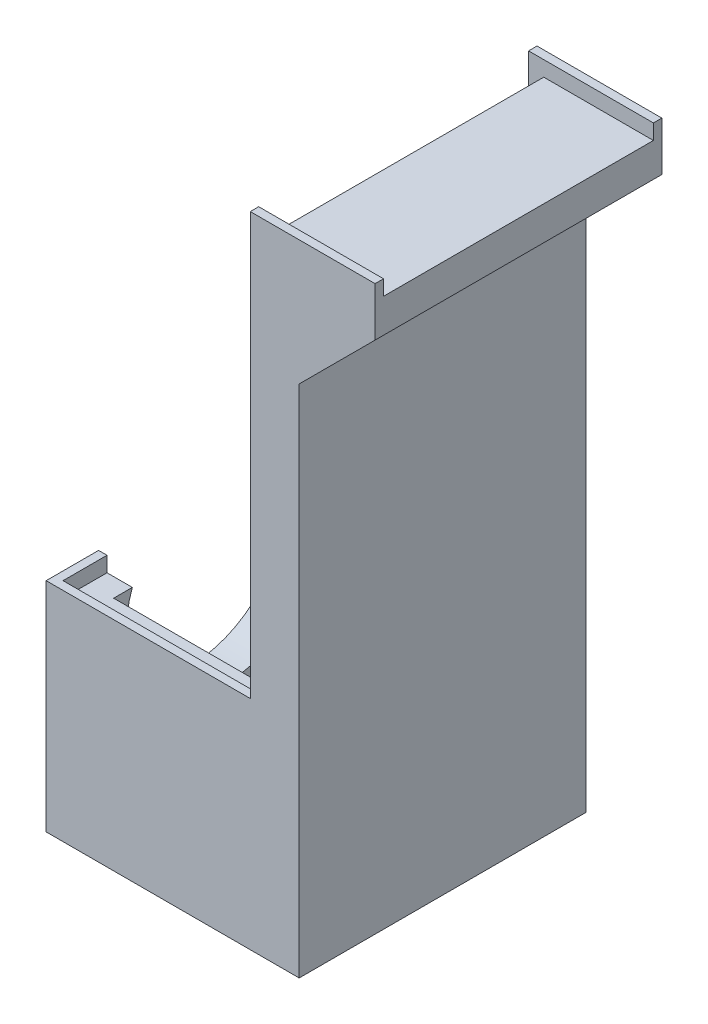
from build123d import *

# Parameters (mm, degrees)
SKETCH1_W           = 13
SKETCH1_H           = 17
BOSS_EXTRUDE1_DEPTH = 2
BOSS_EXTRUDE2_DEPTH = 10
SKETCH3_R           = 5.75
CUT_EXTRUDE1_DEPTH  = 15
SKETCH4_W           = 17
SKETCH4_H           = 37
BOSS_EXTRUDE3_DEPTH = 2
SKETCH5_W           = 17
SKETCH5_H           = 2
BOSS_EXTRUDE4_DEPTH = 4.5
BOSS_EXTRUDE5_DEPTH = 0.9
SKETCH7_W           = 0.5
SKETCH7_H           = 24.1
BOSS_EXTRUDE6_DEPTH = 0.9
SKETCH8_W           = 7.4
SKETCH8_H           = 0.5
BOSS_EXTRUDE7_DEPTH = 0.9
BOSS_EXTRUDE8_DEPTH = 17


with BuildPart() as part:
    # Sketch1 → Boss-Extrude1 (new body)
    with BuildSketch(Plane(origin=(0, 0, 0), x_dir=(1, 0, 0), z_dir=(0, 1, 0))):
        Rectangle(SKETCH1_W, SKETCH1_H)
    extrude(amount=BOSS_EXTRUDE1_DEPTH)

    # Sketch2 → Boss-Extrude2 (add)
    with BuildSketch(Plane(origin=(0, 2, 0), x_dir=(1, 0, 0), z_dir=(0, 1, 0))):
        Polygon((-6.5, 8.5), (-6.5, -8.5), (6.5, -8.5), (6.5, -6.5), (-4.5, -6.5), (-4.5, 6.5), (6.5, 6.5), (6.5, 8.5), align=None)
    extrude(amount=BOSS_EXTRUDE2_DEPTH)

    # Sketch3 → Cut-Extrude1 (cut)
    with BuildSketch(Plane.ZY.offset(6.5)):
        with Locations((0, 10)):
            Circle(SKETCH3_R)
    extrude(amount=-CUT_EXTRUDE1_DEPTH, mode=Mode.SUBTRACT)

    # Sketch4 → Boss-Extrude3 (add)
    with BuildSketch(Plane(origin=(6.5, 0, 0), x_dir=(0, 0, -1), z_dir=(1, 0, 0))):
        with Locations((0, 18.5)):
            Rectangle(SKETCH4_W, SKETCH4_H)
    extrude(amount=BOSS_EXTRUDE3_DEPTH)

    # Sketch5 → Boss-Extrude4 (add)
    with BuildSketch(Plane(origin=(8.5, 0, 0), x_dir=(0, 0, -1), z_dir=(1, 0, 0))):
        with Locations((0, 36)):
            Rectangle(SKETCH5_W, SKETCH5_H)
    extrude(amount=BOSS_EXTRUDE4_DEPTH)

    # Sketch6 → Boss-Extrude5 (add)
    with BuildSketch(Plane(origin=(0, 12, 0), x_dir=(1, 0, 0), z_dir=(0, 1, 0))):
        Polygon((-6, 5.390964663), (-6.5, 5.390964663), (-6.5, 8.5), (6.5, 8.5), (6.5, 8), (-6, 8), align=None)
        Polygon((6.5, -8), (-6, -8), (-6, -5.390964663), (-6.5, -5.390964663), (-6.5, -8.5), (6.5, -8.5), align=None)
    extrude(amount=BOSS_EXTRUDE5_DEPTH)

    # Sketch7 → Boss-Extrude6 (add)
    with BuildSketch(Plane.ZY.offset(-6.5)):
        with Locations((-8.25, 24.95)):
            Rectangle(SKETCH7_W, SKETCH7_H)
        with Locations((8.25, 24.95)):
            Rectangle(SKETCH7_W, SKETCH7_H)
    extrude(amount=BOSS_EXTRUDE6_DEPTH)

    # Sketch8 → Boss-Extrude7 (add)
    with BuildSketch(Plane(origin=(0, 37, 0), x_dir=(1, 0, 0), z_dir=(0, 1, 0))):
        with Locations((9.3, 8.25)):
            Rectangle(SKETCH8_W, SKETCH8_H)
        with Locations((9.3, -8.25)):
            Rectangle(SKETCH8_W, SKETCH8_H)
    extrude(amount=BOSS_EXTRUDE7_DEPTH)

    # Sketch9 → Boss-Extrude8 (add)
    with BuildSketch(Plane.XY.offset(8.5)):
        Polygon((13, 35), (8.5, 30.5), (8.5, 35), align=None)
    extrude(amount=-BOSS_EXTRUDE8_DEPTH)


solid = part.part
